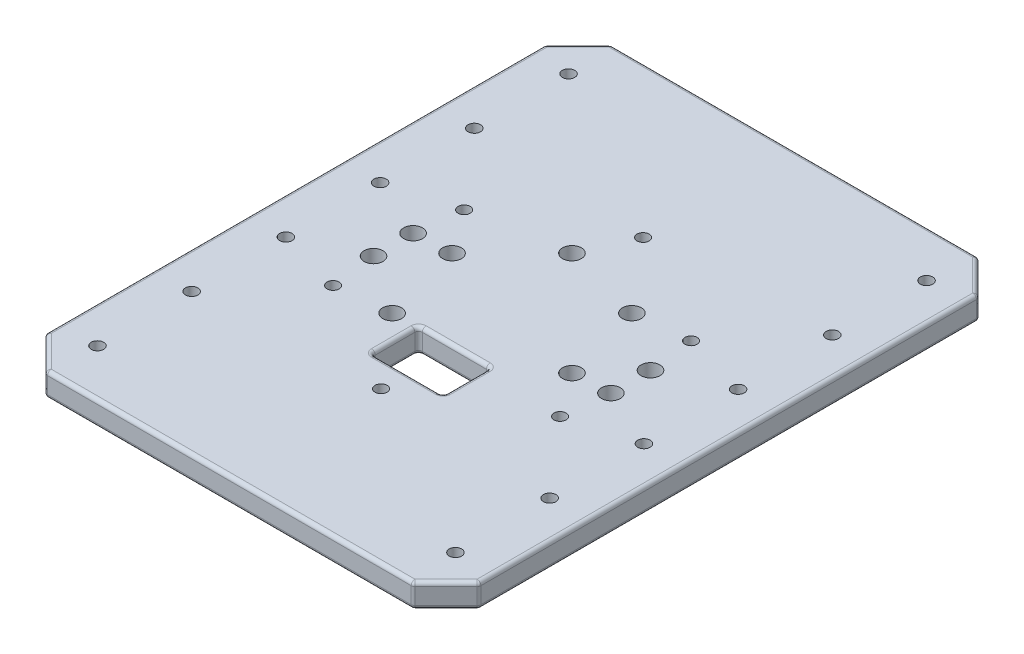
from build123d import *

# Parameters (mm, degrees)
BOSS_EXTRUDE1_DEPTH                        = 12.7
SKETCH8_R                                  = 3.3
CUT_EXTRUDE1_DEPTH                         = 12.7
LPATTERN1_COUNT                            = 6
LPATTERN1_PITCH                            = 50
MIRROR1_COPY_1_SKETCH_R                    = 3.3
MIRROR1_COPY_1_DEPTH                       = 12.7
MIRROR1_COPY_2_SKETCH_R                    = 3.3
MIRROR1_COPY_2_DEPTH                       = 12.7
MIRROR1_COPY_3_SKETCH_R                    = 3.3
MIRROR1_COPY_3_DEPTH                       = 12.7
MIRROR1_COPY_4_SKETCH_R                    = 3.3
MIRROR1_COPY_4_DEPTH                       = 12.7
MIRROR1_COPY_5_SKETCH_R                    = 3.3
MIRROR1_COPY_5_DEPTH                       = 12.7
SKETCH14_R                                 = 3.2
CUT_EXTRUDE6_DEPTH                         = 190.436770454
CIRPATTERN1_COUNT                          = 6
FILLET1_R                                  = 2
CUT_EXTRUDE7_REACH                         = 191.437
SKETCH15_R                                 = 5
CUT_EXTRUDE8_REACH                         = 191.437
SKETCH17_R                                 = 5
MIRROR2_AT_THE_SECOND_PLANE_COPY_1_REACH   = 191.437
MIRROR2_AT_THE_SECOND_PLANE_COPY_1_SKETC_R = 5
CUT_EXTRUDE9_REACH                         = 191.437
SKETCH18_W                                 = 38
SKETCH18_H                                 = 25
FILLET3_R                                  = 2


with BuildPart() as part:
    # Sketch2 → Boss-Extrude1 (new body)
    with BuildSketch(Plane(origin=(0, 0, 0), x_dir=(1, 0, 0), z_dir=(0, 1, 0))):
        Polygon((-97.32233047, 150), (97.32233047, 150), (115, 132.32233047), (115, -132.32233047), (97.32233047, -150), (-97.32233047, -150), (-115, -132.32233047), (-115, 132.32233047), align=None)
    extrude(amount=BOSS_EXTRUDE1_DEPTH)

    # Sketch8 → Cut-Extrude1 (cut)
    with BuildSketch(Plane(origin=(0, 12.7, 0), x_dir=(1, 0, 0), z_dir=(0, 1, 0))):
        with Locations(Location((95, -125, 0), (0, 0, 270))):
            Circle(SKETCH8_R)
    cut_extrude1 = extrude(amount=-CUT_EXTRUDE1_DEPTH, mode=Mode.SUBTRACT)

    # LPattern1: Cut-Extrude1 ×6
    with Locations(*[(0, 0, -i * LPATTERN1_PITCH) for i in range(1, LPATTERN1_COUNT)]):
        add(cut_extrude1, mode=Mode.SUBTRACT)

    # Mirror1: Cut-Extrude1 across plane
    add(cut_extrude1.mirror(Plane(origin=(0, 0, 0), x_dir=(0, 0, 1), z_dir=(1, 0, 0))), mode=Mode.SUBTRACT)

    # Mirror1 copy 1 sketch → Mirror1 copy 1 (cut)
    with BuildSketch(Plane(origin=(0, 12.7, -50), x_dir=(-1, 0, 0), z_dir=(0, 1, 0))):
        with Locations((95, 125)):
            Circle(MIRROR1_COPY_1_SKETCH_R)
    extrude(amount=-MIRROR1_COPY_1_DEPTH, mode=Mode.SUBTRACT)

    # Mirror1 copy 2 sketch → Mirror1 copy 2 (cut)
    with BuildSketch(Plane(origin=(0, 12.7, -100), x_dir=(-1, 0, 0), z_dir=(0, 1, 0))):
        with Locations((95, 125)):
            Circle(MIRROR1_COPY_2_SKETCH_R)
    extrude(amount=-MIRROR1_COPY_2_DEPTH, mode=Mode.SUBTRACT)

    # Mirror1 copy 3 sketch → Mirror1 copy 3 (cut)
    with BuildSketch(Plane(origin=(0, 12.7, -150), x_dir=(-1, 0, 0), z_dir=(0, 1, 0))):
        with Locations((95, 125)):
            Circle(MIRROR1_COPY_3_SKETCH_R)
    extrude(amount=-MIRROR1_COPY_3_DEPTH, mode=Mode.SUBTRACT)

    # Mirror1 copy 4 sketch → Mirror1 copy 4 (cut)
    with BuildSketch(Plane(origin=(0, 12.7, -200), x_dir=(-1, 0, 0), z_dir=(0, 1, 0))):
        with Locations((95, 125)):
            Circle(MIRROR1_COPY_4_SKETCH_R)
    extrude(amount=-MIRROR1_COPY_4_DEPTH, mode=Mode.SUBTRACT)

    # Mirror1 copy 5 sketch → Mirror1 copy 5 (cut)
    with BuildSketch(Plane(origin=(0, 12.7, -250), x_dir=(-1, 0, 0), z_dir=(0, 1, 0))):
        with Locations((95, 125)):
            Circle(MIRROR1_COPY_5_SKETCH_R)
    extrude(amount=-MIRROR1_COPY_5_DEPTH, mode=Mode.SUBTRACT)

    # Sketch14 → Cut-Extrude6 (cut, through all)
    with BuildSketch(Plane.XZ):
        with Locations(Location((0, 69.5, 0), (0, 0, 270))):
            Circle(SKETCH14_R)
    cut_extrude6 = extrude(amount=-CUT_EXTRUDE6_DEPTH, mode=Mode.SUBTRACT)

    # CirPattern1: Cut-Extrude6 ×6 about axis
    cirpattern1_axis = Axis((0, 0, -0.032912313), (0, 1, 0))
    for i in range(1, CIRPATTERN1_COUNT):
        add(cut_extrude6.rotate(cirpattern1_axis, i * 360 / CIRPATTERN1_COUNT), mode=Mode.SUBTRACT)

    # Fillet1
    fillet1_edges = [part.edges().sort_by_distance(p)[0] for p in [
        (0, 0, 150),
        (-106.161165235, 0, 141.161165235),
        (-115, 0, 0),
        (-106.161165235, 0, -141.161165235),
        (-106.161165235, 12.7, 141.161165235),
        (-97.32233047, 6.35, -150),
        (97.32233047, 6.35, -150),
        (115, 6.35, -132.32233047),
        (115, 6.35, 132.32233047),
        (97.32233047, 6.35, 150),
        (-97.32233047, 6.35, 150),
        (-115, 6.35, 132.32233047),
        (-115, 6.35, -132.32233047),
        (0, 12.7, 150),
        (106.161165235, 12.7, 141.161165235),
        (115, 12.7, 0),
        (106.161165235, 12.7, -141.161165235),
        (0, 12.7, -150),
        (-106.161165235, 12.7, -141.161165235),
        (0, 0, -150),
        (-115, 12.7, 0),
        (106.161165235, 0, -141.161165235),
        (115, 0, 0),
        (106.161165235, 0, 141.161165235),
    ]]
    fillet(fillet1_edges, radius=FILLET1_R)

    # Sketch15 → Cut-Extrude7 (cut, up to next)
    with BuildSketch(Plane.XZ, mode=Mode.PRIVATE) as cut_extrude7_sk1:
        with Locations(Location((11.64685703, 43.466662183, 0), (0, 0, 270))):
            Circle(SKETCH15_R)
    cut_extrude7_tool1 = extrude(cut_extrude7_sk1.sketch, amount=-CUT_EXTRUDE7_REACH, mode=Mode.PRIVATE) & part.part
    # Sketch15 → Cut-Extrude7 (cut, up to next)
    with BuildSketch(Plane.XZ, mode=Mode.PRIVATE) as cut_extrude7_sk2:
        with Locations(Location((43.466662183, 11.64685703, 0), (0, 0, 270))):
            Circle(SKETCH15_R)
    cut_extrude7_tool2 = extrude(cut_extrude7_sk2.sketch, amount=-CUT_EXTRUDE7_REACH, mode=Mode.PRIVATE) & part.part
    # Sketch15 → Cut-Extrude7 (cut, up to next)
    with BuildSketch(Plane.XZ, mode=Mode.PRIVATE) as cut_extrude7_sk3:
        with Locations(Location((31.819805153, -31.819805153, 0), (0, 0, 270))):
            Circle(SKETCH15_R)
    cut_extrude7_tool3 = extrude(cut_extrude7_sk3.sketch, amount=-CUT_EXTRUDE7_REACH, mode=Mode.PRIVATE) & part.part
    # Sketch15 → Cut-Extrude7 (cut, up to next)
    with BuildSketch(Plane.XZ, mode=Mode.PRIVATE) as cut_extrude7_sk4:
        with Locations(Location((-11.64685703, -43.466662183, 0), (0, 0, 270))):
            Circle(SKETCH15_R)
    cut_extrude7_tool4 = extrude(cut_extrude7_sk4.sketch, amount=-CUT_EXTRUDE7_REACH, mode=Mode.PRIVATE) & part.part
    # Sketch15 → Cut-Extrude7 (cut, up to next)
    with BuildSketch(Plane.XZ, mode=Mode.PRIVATE) as cut_extrude7_sk5:
        with Locations(Location((-43.466662183, -11.64685703, 0), (0, 0, 270))):
            Circle(SKETCH15_R)
    cut_extrude7_tool5 = extrude(cut_extrude7_sk5.sketch, amount=-CUT_EXTRUDE7_REACH, mode=Mode.PRIVATE) & part.part
    # Sketch15 → Cut-Extrude7 (cut, up to next)
    with BuildSketch(Plane.XZ, mode=Mode.PRIVATE) as cut_extrude7_sk6:
        with Locations(Location((-31.819805153, 31.819805153, 0), (0, 0, 270))):
            Circle(SKETCH15_R)
    cut_extrude7_tool6 = extrude(cut_extrude7_sk6.sketch, amount=-CUT_EXTRUDE7_REACH, mode=Mode.PRIVATE) & part.part
    add(cut_extrude7_tool1.solids().sort_by_distance((11.646857, 0, 43.466662))[0], mode=Mode.SUBTRACT)
    add(cut_extrude7_tool2.solids().sort_by_distance((43.466662, 0, 11.646857))[0], mode=Mode.SUBTRACT)
    add(cut_extrude7_tool3.solids().sort_by_distance((31.819805, 0, -31.819805))[0], mode=Mode.SUBTRACT)
    add(cut_extrude7_tool4.solids().sort_by_distance((-11.646857, 0, -43.466662))[0], mode=Mode.SUBTRACT)
    add(cut_extrude7_tool5.solids().sort_by_distance((-43.466662, 0, -11.646857))[0], mode=Mode.SUBTRACT)
    add(cut_extrude7_tool6.solids().sort_by_distance((-31.819805, 0, 31.819805))[0], mode=Mode.SUBTRACT)

    # Sketch17 → Cut-Extrude8 (cut, up to next)
    with BuildSketch(Plane.XZ, mode=Mode.PRIVATE) as cut_extrude8_sk1:
        with Locations(Location((-63, 10.5, 0), (0, 0, 270))):
            Circle(SKETCH17_R)
    cut_extrude8_tool1 = extrude(cut_extrude8_sk1.sketch, amount=-CUT_EXTRUDE8_REACH, mode=Mode.PRIVATE) & part.part
    cut_extrude8 = cut_extrude8_tool1.solids().sort_by_distance((-63, 0, 10.5))[0]
    add(cut_extrude8, mode=Mode.SUBTRACT)

    # Mirror2: Cut-Extrude8 across plane
    add(cut_extrude8.mirror(Plane.XY), mode=Mode.SUBTRACT)

    # Mirror2 at the second plane: Cut-Extrude8 across plane
    add(cut_extrude8.mirror(Plane(origin=(0, 0, 0), x_dir=(0, 0, 1), z_dir=(1, 0, 0))), mode=Mode.SUBTRACT)

    # Mirror2 at the second plane copy 1 sketc → Mirror2 at the second plane copy 1 (cut, up to next)
    with BuildSketch(Plane(origin=(0, 0, 0), x_dir=(-1, 0, 0), z_dir=(0, -1, 0)), mode=Mode.PRIVATE) as mirror2_at_the_second_plane_copy_1_sk1:
        with Locations(Location((-63, 10.5, 0), (0, 0, 270))):
            Circle(MIRROR2_AT_THE_SECOND_PLANE_COPY_1_SKETC_R)
    mirror2_at_the_second_plane_copy_1_tool1 = extrude(mirror2_at_the_second_plane_copy_1_sk1.sketch, amount=-MIRROR2_AT_THE_SECOND_PLANE_COPY_1_REACH, mode=Mode.PRIVATE) & part.part
    add(mirror2_at_the_second_plane_copy_1_tool1.solids().sort_by_distance((63, 0, -10.5))[0], mode=Mode.SUBTRACT)

    # Sketch18 → Cut-Extrude9 (cut, up to next)
    with BuildSketch(Plane.XZ, mode=Mode.PRIVATE) as cut_extrude9_sk1:
        with Locations((0, 43.08)):
            Rectangle(SKETCH18_W, SKETCH18_H)
    cut_extrude9_tool1 = extrude(cut_extrude9_sk1.sketch, amount=-CUT_EXTRUDE9_REACH, mode=Mode.PRIVATE) & part.part
    add(cut_extrude9_tool1.solids().sort_by_distance((0, 0, 43.08))[0], mode=Mode.SUBTRACT)

    # Fillet3
    fillet3_edges = [part.edges().sort_by_distance(p)[0] for p in [
        (-19, 6.35, 30.58),
        (-19, 6.35, 55.58),
        (19, 6.35, 55.58),
        (19, 6.35, 30.58),
        (-19, 0, 43.08),
        (0, 0, 30.58),
        (19, 0, 43.08),
        (0, 0, 55.58),
        (0, 12.7, 30.58),
        (-19, 12.7, 43.08),
        (0, 12.7, 55.58),
        (19, 12.7, 43.08),
    ]]
    fillet(fillet3_edges, radius=FILLET3_R)


solid = part.part
